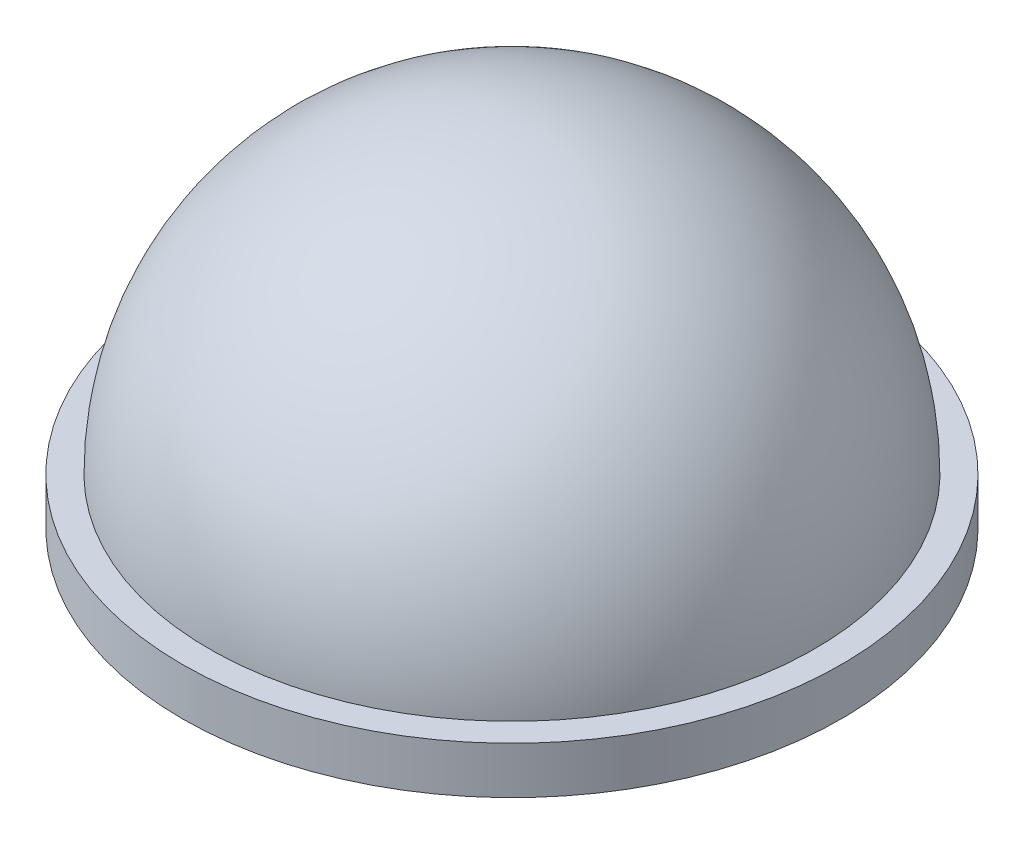
from build123d import *

# Parameters (mm, degrees)
SKETCH_1_R      = 4.9
EXTRUDE_1_DEPTH = 0.7


with BuildPart() as part:
    # 草图1 → 凸台-拉伸1 (new body)
    with BuildSketch(Plane(origin=(0, 0, 0), x_dir=(1, 0, 0), z_dir=(0, 1, 0))):
        with Locations(Location((0, 0, 0), (0, 0, 270))):
            Circle(SKETCH_1_R)
    extrude(amount=EXTRUDE_1_DEPTH)

    # 草图2 → 旋转1 (revolve)
    with BuildSketch(Plane.XY):
        with BuildLine():
            ThreePointArc((0, 5.2), (-3.181980515, 3.881980515), (-4.5, 0.7))
            Line((-4.5, 0.7), (0, 0.7))
            Line((0, 0.7), (0, 5.2))
        make_face()
    revolve(axis=Axis((0, 0.7, 0), (0, 1, 0)))


solid = part.part
